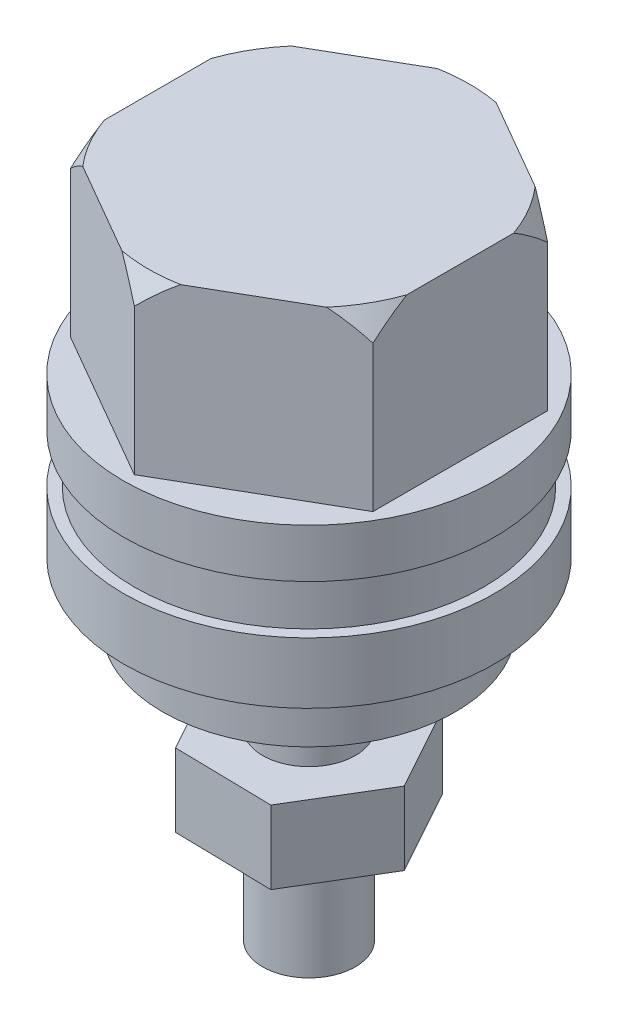
from build123d import *

# Parameters (mm, degrees)
SKETCH_1_R      = 6
EXTRUDE_1_DEPTH = 2.5
SKETCH_2_R      = 7.6
EXTRUDE_2_DEPTH = 2.5
SKETCH_3_R      = 7.15
EXTRUDE_3_DEPTH = 2
SKETCH_4_R      = 7.6
EXTRUDE_4_DEPTH = 2
EXTRUDE_5_DEPTH = 7
EXTRUDE_6_DEPTH = 1.6
SKETCH_9_R      = 1.9
EXTRUDE_7_DEPTH = 9.5
EXTRUDE_START   = 2
EXTRUDE_8_DEPTH = 3


with BuildPart() as part:
    # 草图1 → 凸台-拉伸1 (new body)
    with BuildSketch(Plane(origin=(0, 0, 0), x_dir=(1, 0, 0), z_dir=(0, 1, 0))):
        with Locations(Location((0, 0, 0), (0, 0, 270))):
            Circle(SKETCH_1_R)
    extrude(amount=EXTRUDE_1_DEPTH)

    # 草图2 → 凸台-拉伸2 (add)
    with BuildSketch(Plane(origin=(0, 2.5, 0), x_dir=(1, 0, 0), z_dir=(0, 1, 0))):
        with Locations(Location((0, 0, 0), (0, 0, 270))):
            Circle(SKETCH_2_R)
    extrude(amount=EXTRUDE_2_DEPTH)

    # 草图8 → 凸台-拉伸6 (add)
    with BuildSketch(Plane.XZ):
        with BuildLine():
            Line((1.95, 1.794435844), (1.95, -1.794435844))
            ThreePointArc((1.95, -1.794435844), (0, -2.65), (-1.95, -1.794435844))
            Line((-1.95, -1.794435844), (-1.95, 1.794435844))
            ThreePointArc((-1.95, 1.794435844), (0, 2.65), (1.95, 1.794435844))
        make_face()
    extrude(amount=EXTRUDE_6_DEPTH)

    # 草图9 → 凸台-拉伸7 (add)
    with BuildSketch(Plane.XZ.offset(1.6)):
        with Locations(Location((0, 0, 0), (0, 0, 270))):
            Circle(SKETCH_9_R)
    extrude(amount=EXTRUDE_7_DEPTH)

    # 草图10 → 凸台-拉伸8 (add)
    with BuildSketch(Plane.XZ.offset(1.6).offset(EXTRUDE_START)):
        Polygon((1.923967995, 3.488315805), (-2.058986106, 3.410363062), (-3.982954101, -0.077952742), (-1.923967995, -3.488315805), (2.058986106, -3.410363062), (3.982954101, 0.077952742), align=None)
    extrude(amount=EXTRUDE_8_DEPTH)


with BuildPart() as body_2:
    # 草图3 → 凸台-拉伸3 (new body)
    with BuildSketch(Plane(origin=(0, 5, 0), x_dir=(1, 0, 0), z_dir=(0, 1, 0))):
        with Locations(Location((0, 0, 0), (0, 0, 270))):
            Circle(SKETCH_3_R)
    extrude(amount=EXTRUDE_3_DEPTH)


with BuildPart() as body_3:
    # 草图4 → 凸台-拉伸4 (new body)
    with BuildSketch(Plane(origin=(0, 7, 0), x_dir=(1, 0, 0), z_dir=(0, 1, 0))):
        with Locations(Location((0, 0, 0), (0, 0, 270))):
            Circle(SKETCH_4_R)
    extrude(amount=EXTRUDE_4_DEPTH)


with BuildPart() as body_4:
    # 草图5 → 凸台-拉伸5 (new body)
    with BuildSketch(Plane(origin=(0, 9, 0), x_dir=(1, 0, 0), z_dir=(0, 1, 0))):
        Polygon((0, 7.159143338), (-6.2, 3.579571669), (-6.2, -3.579571669), (0, -7.159143338), (6.2, -3.579571669), (6.2, 3.579571669), align=None)
    extrude(amount=EXTRUDE_5_DEPTH)

    # 草图7 → 切除-旋转2 (revolve, cut)
    with BuildSketch(Plane(origin=(0, 0, 0), x_dir=(0.8660254037844386, 0, 0.5000000000000003), z_dir=(-0.5000000000000002, 0, 0.8660254037844385))):
        Polygon((-6.20982582, 16.639779846), (-7.441584726, 14.4830693), (-8.216009298, 16.639779846), align=None)
    revolve(axis=Axis((0, 16, 0), (0, -1, 0)), mode=Mode.SUBTRACT)


solid = Compound([part.part, body_2.part, body_3.part, body_4.part])
